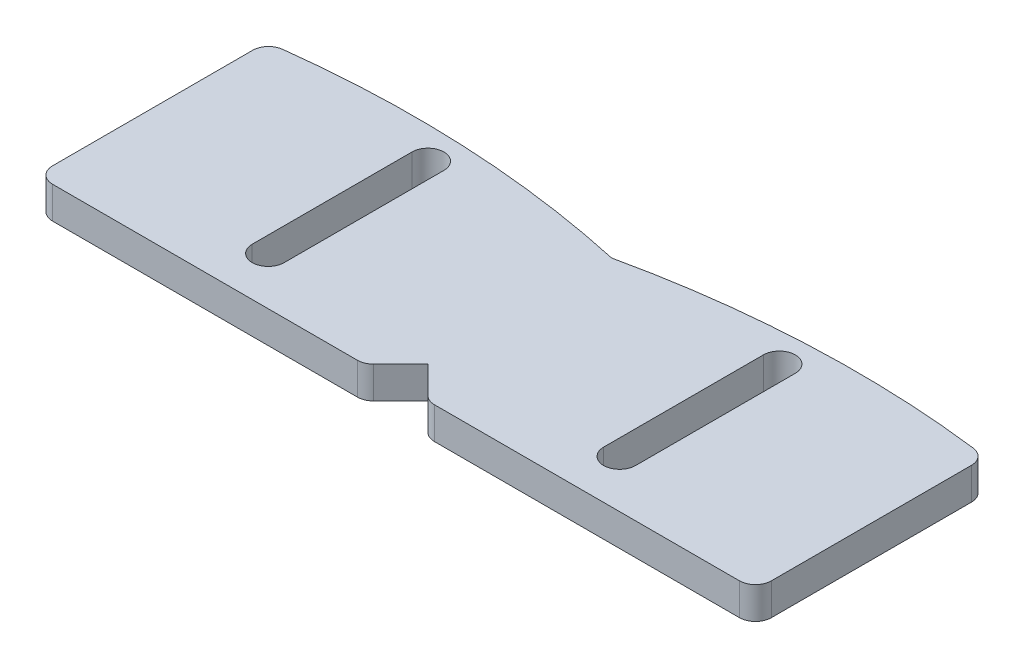
from build123d import *

# Parameters (mm, degrees)
RESSALTO_EXTRUS_O1_DEPTH = 2
FILETE1_R                = 1


with BuildPart() as part:
    # Esboço1 → Ressalto-extrusão1 (new body)
    with BuildSketch(Plane(origin=(0, 0, 0), x_dir=(1, 0, 0), z_dir=(0, 1, 0))):
        with BuildLine():
            ThreePointArc((0, 6), (-6.841228784, 7.123893127), (-13.763951561, 7.5))
            ThreePointArc((-13.763951561, 7.5), (-18.1422658, 7.349823523), (-22.5, 6.9))
            Line((-22.5, 6.9), (-22.5, -7.5))
            Line((-22.5, -7.5), (-2, -7.5))
            Line((-2, -7.5), (0, -5.5))
            Line((0, -5.5), (2, -7.5))
            Line((2, -7.5), (22.5, -7.5))
            Line((22.5, -7.5), (22.5, 6.9))
            ThreePointArc((22.5, 6.9), (18.1422658, 7.349823523), (13.763951559, 7.5))
            ThreePointArc((13.763951559, 7.5), (6.841228783, 7.123893127), (0, 6))
        make_face()
        with BuildLine():
            ThreePointArc((-12, 5.5), (-11, 6.5), (-10, 5.5))
            Line((-10, 5.5), (-10, -4.5))
            ThreePointArc((-10, -4.5), (-11, -5.5), (-12, -4.5))
            Line((-12, -4.5), (-12, 5.5))
        make_face(mode=Mode.SUBTRACT)
        with BuildLine():
            Line((10, -4.5), (10, 5.5))
            ThreePointArc((10, 5.5), (11, 6.5), (12, 5.5))
            Line((12, 5.5), (12, -4.5))
            ThreePointArc((12, -4.5), (11, -5.5), (10, -4.5))
        make_face(mode=Mode.SUBTRACT)
    extrude(amount=RESSALTO_EXTRUS_O1_DEPTH)

    # Filete1
    filete1_edges = [part.edges().sort_by_distance(p)[0] for p in [
        (22.5, 1, -6.9),
        (22.5, 1, 7.5),
        (2, 1, 7.5),
        (-2, 1, 7.5),
        (-22.5, 1, 7.5),
        (-22.5, 1, -6.9),
    ]]
    fillet(filete1_edges, radius=FILETE1_R)


solid = part.part
